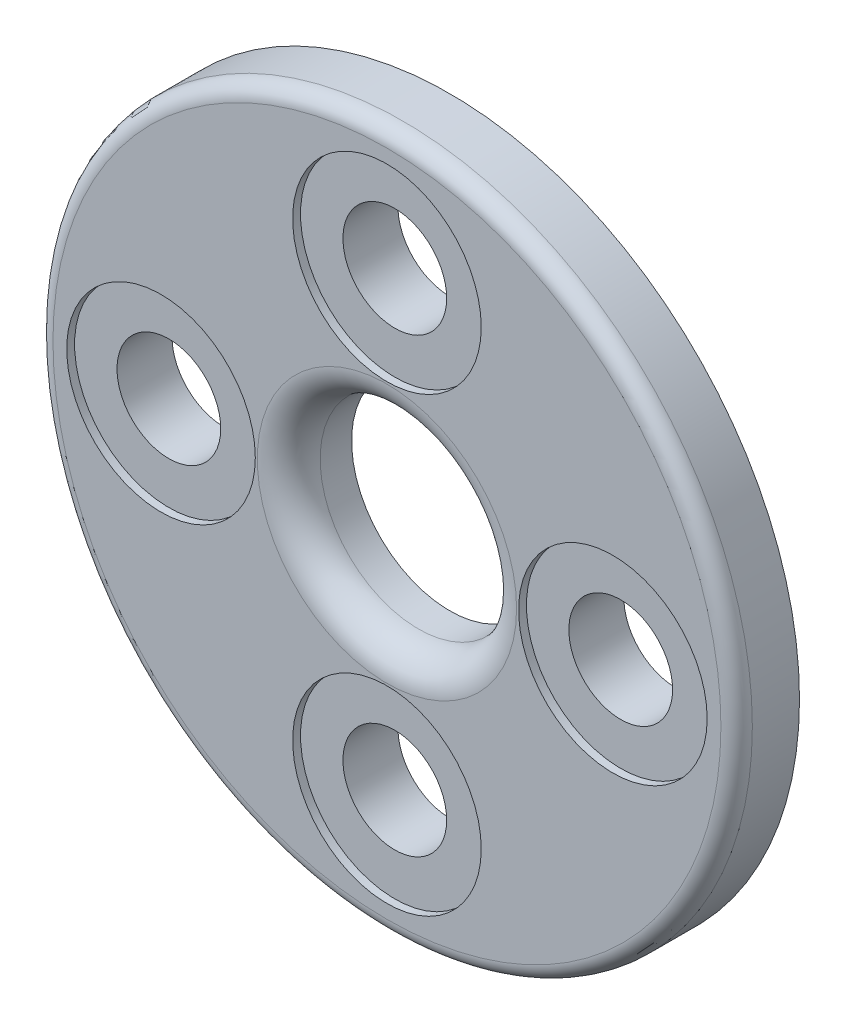
from build123d import *

# Parameters (mm, degrees)
SKETCH_1_R                   = 22.25
SKETCH_1_R_2                 = 6.25
EXTRUDE_1_DEPTH              = 4
HOLE_WIZARD_M6_1_D           = 6.6
HOLE_WIZARD_M6_1_CBORE_D     = 12
HOLE_WIZARD_M6_1_CBORE_DEPTH = 0.5
FILLET_1_R                   = 1
FILLET_2_R                   = 2


with BuildPart() as part:
    # 草图1 → 凸台-拉伸1 (new body)
    with BuildSketch(Plane.XY):
        Circle(SKETCH_1_R)
        Circle(SKETCH_1_R_2, mode=Mode.SUBTRACT)
    extrude(amount=EXTRUDE_1_DEPTH)

    # M6 六角头螺栓的柱形沉头孔1 (through all)
    with Locations(Plane.XY.offset(4)):
        with Locations((-14.375, 0), (0, 14.375), (14.375, 0), (0, -14.375)):
            CounterBoreHole(HOLE_WIZARD_M6_1_D / 2, HOLE_WIZARD_M6_1_CBORE_D / 2, HOLE_WIZARD_M6_1_CBORE_DEPTH)

    # 圆角1
    fillet_1_edges = [part.edges().sort_by_distance(p)[0] for p in [
        (-22.25, 0, 4),
    ]]
    fillet(fillet_1_edges, radius=FILLET_1_R)

    # 圆角2
    fillet_2_edges = [part.edges().sort_by_distance(p)[0] for p in [
        (-6.25, 0, 4),
    ]]
    fillet(fillet_2_edges, radius=FILLET_2_R)


solid = part.part
